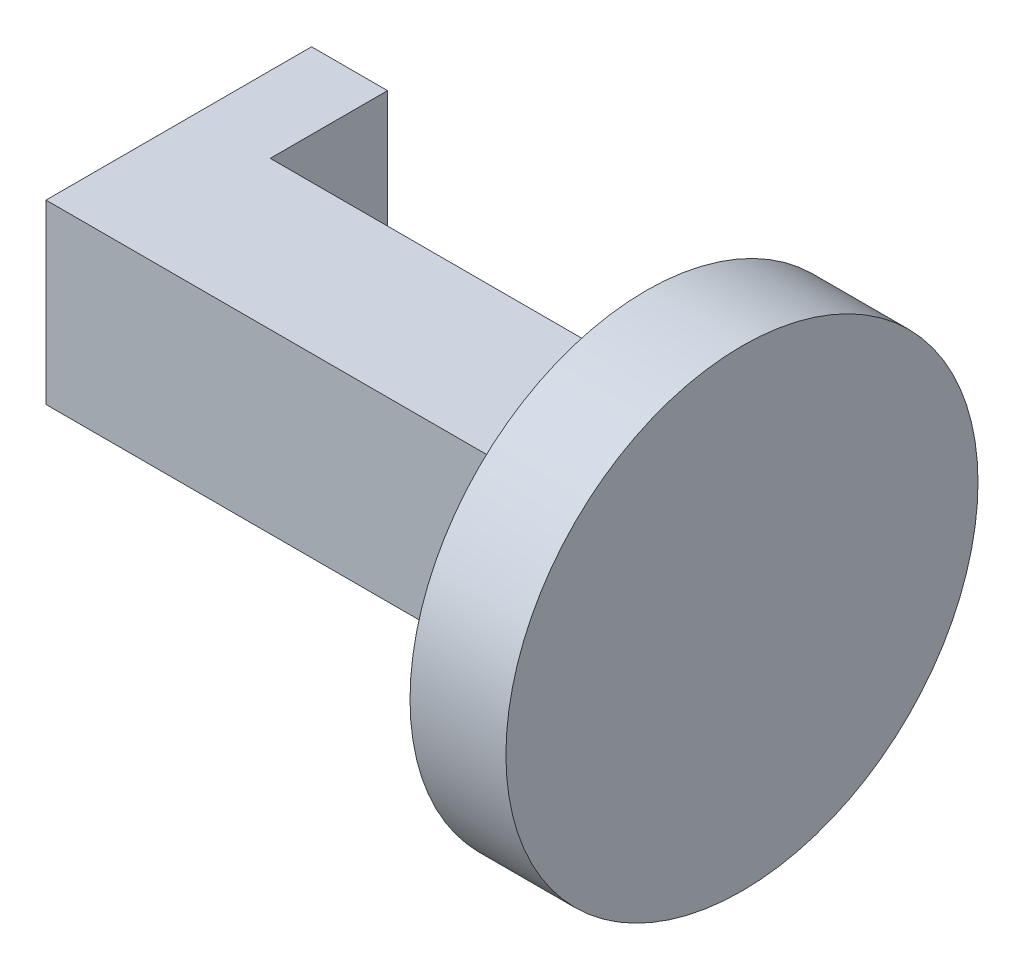
from build123d import *

# Parameters (mm, degrees)
SKETCH_1_W      = 5.15
SKETCH_1_H      = 5.025
EXTRUDE_1_DEPTH = 12
SKETCH_2_R      = 0.6
EXTRUDE_2_DEPTH = 11.6
SKETCH_3_R      = 16
EXTRUDE_3_DEPTH = 6.5


with BuildPart() as part:
    # 草图1 → 凸台-拉伸1 (new body)
    with BuildSketch(Plane(origin=(0, 0, 0), x_dir=(1, 0, 0), z_dir=(0, 1, 0))):
        Polygon((-10.125, 5.025), (-10.125, 0), (-10.125, -5.025), (15.275, -5.025), (15.275, 5.025), align=None)
        Polygon((-15.275, 12.975), (-15.275, 0), (-10.125, 0), (-10.125, 5.025), (-10.125, 12.975), align=None)
        with Locations((-12.7, -2.5125)):
            Rectangle(SKETCH_1_W, SKETCH_1_H)
    extrude(amount=EXTRUDE_1_DEPTH)

    # 草图2 → 凸台-拉伸2 (add)
    with BuildSketch(Plane(origin=(15.275, 0, 0), x_dir=(0, 0, -1), z_dir=(1, 0, 0))):
        with Locations(Location((0, 6, 0), (0, 0, 180))):
            Circle(SKETCH_2_R)
    extrude(amount=EXTRUDE_2_DEPTH)

    # 草图3 → 凸台-拉伸3 (add)
    with BuildSketch(Plane(origin=(26.875, 0, 0), x_dir=(0, 0, -1), z_dir=(1, 0, 0))):
        with Locations((0, 6)):
            Circle(SKETCH_3_R)
    extrude(amount=-EXTRUDE_3_DEPTH)


solid = part.part
